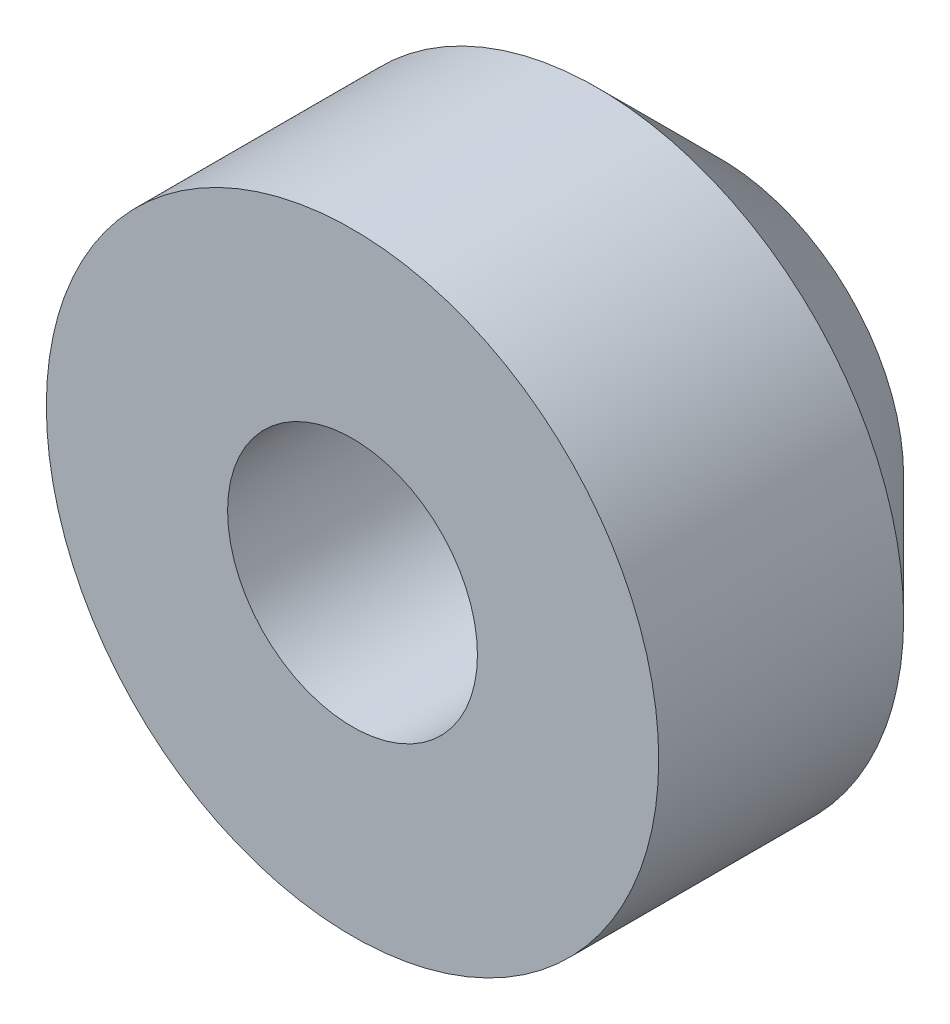
from build123d import *

# Parameters (mm, degrees)
SKETCH1_R           = 12.5
SKETCH1_R_2         = 5.1
BOSS_EXTRUDE1_DEPTH = 15
CHAMFER1_SIZE       = 5


with BuildPart() as part:
    # Sketch1 → Boss-Extrude1 (new body)
    with BuildSketch(Plane.XY):
        Circle(SKETCH1_R)
        Circle(SKETCH1_R_2, mode=Mode.SUBTRACT)
    extrude(amount=BOSS_EXTRUDE1_DEPTH)

    # Chamfer1
    chamfer1_edges = [part.edges().sort_by_distance(p)[0] for p in [
        (-12.5, 0, 0),
    ]]
    chamfer(chamfer1_edges, length=CHAMFER1_SIZE)


solid = part.part
